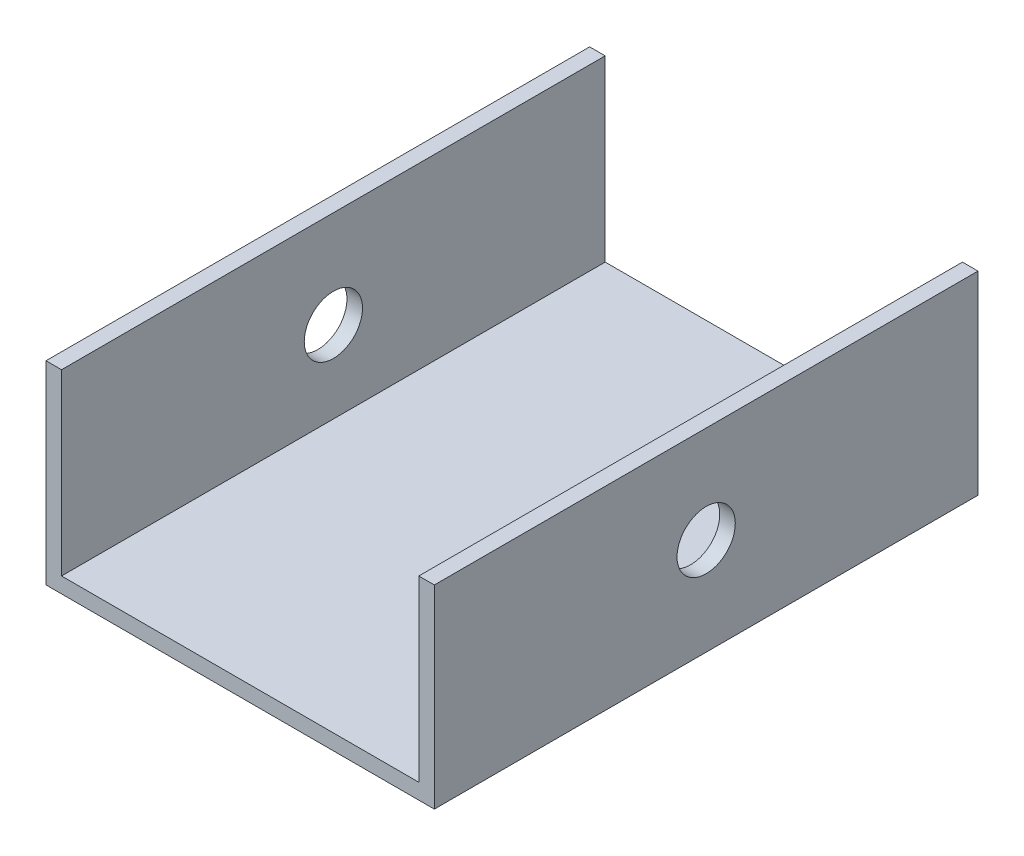
from build123d import *

# Parameters (mm, degrees)
BOSS_EXTRUDE1_DEPTH     = 140
CUT_EXTRUDE1_DEPTH      = 174.980077517
CUT_EXTRUDE1_DEPTH_BACK = 174.980077517
SKETCH2_R               = 7.5


with BuildPart() as part:
    # Sketch1 → Boss-Extrude1 (new body)
    with BuildSketch(Plane.XY):
        Polygon((-38.824195441, 25.86633667), (-34.824195441, 25.86633667), (-34.824195441, -20.133663278), (57.175804455, -20.133663278), (57.175804455, 25.866336594), (61.175804559, 25.866336594), (61.175804559, -24.133663406), (-38.824195441, -24.133663406), align=None)
    extrude(amount=BOSS_EXTRUDE1_DEPTH)

    # Sketch2 → Cut-Extrude1 (cut, two sides: drawn at the far end of the back side and taken through both)
    with BuildSketch(Plane(origin=(61.175804559, 0, 0), x_dir=(0, 0, -1), z_dir=(1, 0, 0)).offset(-CUT_EXTRUDE1_DEPTH_BACK)):
        with Locations(Location((-70, 0.866336594, 0), (0, 0, 90))):
            Circle(SKETCH2_R)
    extrude(amount=CUT_EXTRUDE1_DEPTH + CUT_EXTRUDE1_DEPTH_BACK, mode=Mode.SUBTRACT)


solid = part.part
